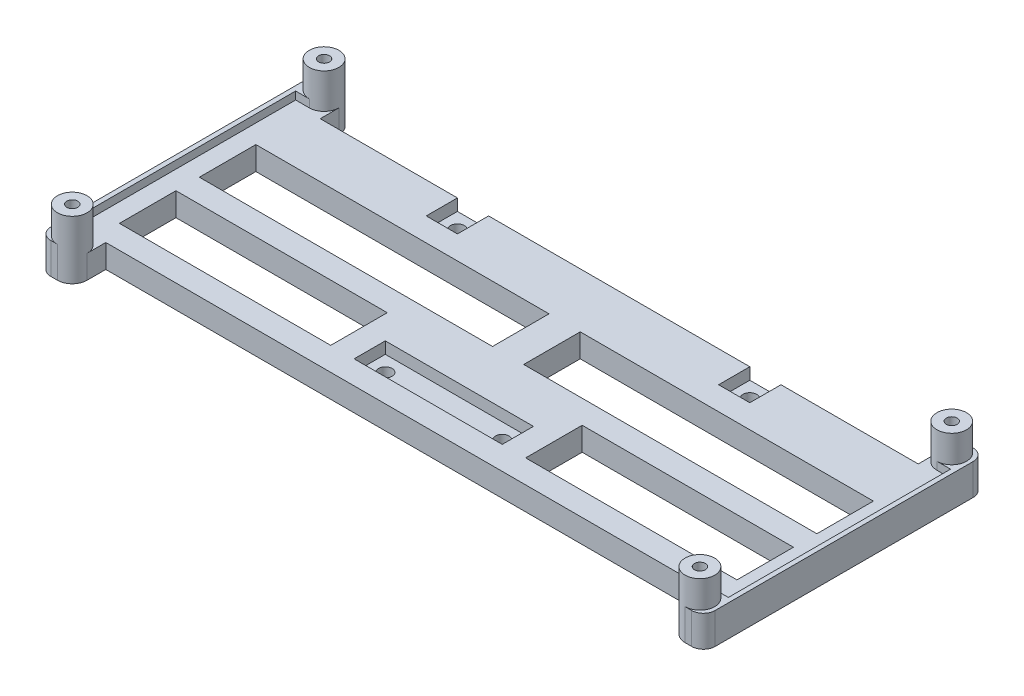
from build123d import *

# Parameters (mm, degrees)
SCHIZZO1_R                   = 1.4
ESTRUSIONE_ESTRUSIONE1_DEPTH = 6
SCHIZZO2_R                   = 3.8
SCHIZZO2_R_2                 = 1.4
ESTRUSIONE_ESTRUSIONE2_DEPTH = 9
SCHIZZO3_R                   = 1.75
TAGLIO_ESTRUSIONE1_DEPTH     = 93.969080882
SCHIZZO5_W                   = 8
SCHIZZO5_H                   = 8
SCHIZZO5_W_2                 = 38
TAGLIO_ESTRUSIONE2_DEPTH     = 3
SCHIZZO6_W                   = 75.2
SCHIZZO6_H                   = 14.5
SCHIZZO6_W_2                 = 54.2
TAGLIO_ESTRUSIONE3_DEPTH     = 93.969080882
ESTRUSIONE_ESTRUSIONE4_DEPTH = 2
RACCORDO1_R                  = 3


with BuildPart() as part:
    # Schizzo1 → Estrusione-Estrusione1 (new body)
    with BuildSketch(Plane(origin=(0, 0, 0), x_dir=(1, 0, 0), z_dir=(0, 1, 0))):
        with BuildLine():
            Line((-76.7, -27.5), (-76.7, -32.3))
            ThreePointArc((-76.7, -32.3), (-77.812994231, -34.987005769), (-80.5, -36.1))
            Line((-80.5, -36.1), (-85.2, -36.1))
            Line((-85.2, -36.1), (-85.2, 36.1))
            Line((-85.2, 36.1), (-80.5, 36.1))
            ThreePointArc((-80.5, 36.1), (-77.812994231, 34.987005769), (-76.7, 32.3))
            Line((-76.7, 32.3), (-76.7, 27.5))
            Line((-76.7, 27.5), (76.7, 27.5))
            Line((76.7, 27.5), (76.7, 32.3))
            ThreePointArc((76.7, 32.3), (77.812994231, 34.987005769), (80.5, 36.1))
            Line((80.5, 36.1), (85.2, 36.1))
            Line((85.2, 36.1), (85.2, -36.1))
            Line((85.2, -36.1), (80.5, -36.1))
            ThreePointArc((80.5, -36.1), (77.812994231, -34.987005769), (76.7, -32.3))
            Line((76.7, -32.3), (76.7, -27.5))
            Line((76.7, -27.5), (-76.7, -27.5))
        make_face()
        with Locations(Location((-80.5, 32.3, 0), (0, 0, 270))):
            Circle(SCHIZZO1_R, mode=Mode.SUBTRACT)
        with Locations(Location((-80.5, -32.3, 0), (0, 0, 270))):
            Circle(SCHIZZO1_R, mode=Mode.SUBTRACT)
        with Locations(Location((80.5, -32.3, 0), (0, 0, 270))):
            Circle(SCHIZZO1_R, mode=Mode.SUBTRACT)
        with Locations(Location((80.5, 32.3, 0), (0, 0, 270))):
            Circle(SCHIZZO1_R, mode=Mode.SUBTRACT)
    extrude(amount=ESTRUSIONE_ESTRUSIONE1_DEPTH)

    # Schizzo2 → Estrusione-Estrusione2 (add)
    # profile 1 of 4: a face of its own
    with BuildSketch(Plane(origin=(0, 6, 0), x_dir=(1, 0, 0), z_dir=(0, 1, 0))):
        with Locations(Location((-80.5, 32.3, 0), (0, 0, 90))):
            Circle(SCHIZZO2_R)
        with Locations(Location((-80.5, 32.3, 0), (0, 0, 270))):
            Circle(SCHIZZO2_R_2, mode=Mode.SUBTRACT)
    # profile 2 of 4: a face of its own
    with BuildSketch(Plane(origin=(0, 6, 0), x_dir=(1, 0, 0), z_dir=(0, 1, 0))):
        with Locations(Location((-80.5, -32.3, 0), (0, 0, 270))):
            Circle(SCHIZZO2_R)
        with Locations(Location((-80.5, -32.3, 0), (0, 0, 270))):
            Circle(SCHIZZO2_R_2, mode=Mode.SUBTRACT)
    # profile 3 of 4: a face of its own
    with BuildSketch(Plane(origin=(0, 6, 0), x_dir=(1, 0, 0), z_dir=(0, 1, 0))):
        with Locations(Location((80.5, -32.3, 0), (0, 0, 270))):
            Circle(SCHIZZO2_R)
        with Locations(Location((80.5, -32.3, 0), (0, 0, 270))):
            Circle(SCHIZZO2_R_2, mode=Mode.SUBTRACT)
    # profile 4 of 4: a face of its own
    with BuildSketch(Plane(origin=(0, 6, 0), x_dir=(1, 0, 0), z_dir=(0, 1, 0))):
        with Locations(Location((80.5, 32.3, 0), (0, 0, 90))):
            Circle(SCHIZZO2_R)
        with Locations(Location((80.5, 32.3, 0), (0, 0, 270))):
            Circle(SCHIZZO2_R_2, mode=Mode.SUBTRACT)
    extrude(amount=ESTRUSIONE_ESTRUSIONE2_DEPTH)

    # Schizzo3 → Taglio-Estrusione1 (cut, through all)
    with BuildSketch(Plane(origin=(0, 6, 0), x_dir=(1, 0, 0), z_dir=(0, 1, 0))):
        with Locations(Location((-37.5, 23.5, 0), (0, 0, 270))):
            Circle(SCHIZZO3_R)
        with Locations(Location((-15, -17.5, 0), (0, 0, 270))):
            Circle(SCHIZZO3_R)
        with Locations(Location((15, -17.5, 0), (0, 0, 270))):
            Circle(SCHIZZO3_R)
        with Locations(Location((37.5, 23.5, 0), (0, 0, 270))):
            Circle(SCHIZZO3_R)
    extrude(amount=-TAGLIO_ESTRUSIONE1_DEPTH, mode=Mode.SUBTRACT)

    # Schizzo5 → Taglio-Estrusione2 (cut)
    with BuildSketch(Plane(origin=(0, 6, 0), x_dir=(1, 0, 0), z_dir=(0, 1, 0))):
        with Locations((37.5, 23.5)):
            Rectangle(SCHIZZO5_W, SCHIZZO5_H)
        with Locations((-37.5, 23.5)):
            Rectangle(SCHIZZO5_W, SCHIZZO5_H)
        with Locations((0, -17.5)):
            Rectangle(SCHIZZO5_W_2, SCHIZZO5_H)
    extrude(amount=-TAGLIO_ESTRUSIONE2_DEPTH, mode=Mode.SUBTRACT)

    # Schizzo6 → Taglio-Estrusione3 (cut, through all)
    with BuildSketch(Plane(origin=(0, 6, 0), x_dir=(1, 0, 0), z_dir=(0, 1, 0))):
        with Locations((-41.6, 6.25)):
            Rectangle(SCHIZZO6_W, SCHIZZO6_H)
        with Locations((41.6, 6.25)):
            Rectangle(SCHIZZO6_W, SCHIZZO6_H)
        with Locations((-52.1, -14.25)):
            Rectangle(SCHIZZO6_W_2, SCHIZZO6_H)
        with Locations((52.1, -14.25)):
            Rectangle(SCHIZZO6_W_2, SCHIZZO6_H)
    extrude(amount=-TAGLIO_ESTRUSIONE3_DEPTH, mode=Mode.SUBTRACT)

    # Schizzo7 → Estrusione-Estrusione4 (add)
    with BuildSketch(Plane(origin=(0, 6, 0), x_dir=(1, 0, 0), z_dir=(0, 1, 0))):
        with BuildLine():
            Line((-80.5, 36.1), (-85.2, 36.1))
            Line((-85.2, 36.1), (-85.2, -36.1))
            Line((-85.2, -36.1), (-80.5, -36.1))
            ThreePointArc((-80.5, -36.1), (-84.3, -32.3), (-80.5, -28.5))
            Line((-80.5, -28.5), (-84, -28.5))
            Line((-84, -28.5), (-84, 28.5))
            Line((-84, 28.5), (-80.5, 28.5))
            ThreePointArc((-80.5, 28.5), (-84.3, 32.3), (-80.5, 36.1))
        make_face()
    estrusione_estrusione4 = extrude(amount=ESTRUSIONE_ESTRUSIONE4_DEPTH)

    # Specchia3: Estrusione-Estrusione4 across plane
    add(estrusione_estrusione4.mirror(Plane(origin=(0, 0, 0), x_dir=(0, 0, 1), z_dir=(1, 0, 0))))

    # Raccordo1
    raccordo1_edges = [part.edges().sort_by_distance(p)[0] for p in [
        (85.2, 4, -36.1),
        (85.2, 4, 36.1),
        (-85.2, 3, 36.1),
        (-85.2, 3, -36.1),
    ]]
    fillet(raccordo1_edges, radius=RACCORDO1_R)


solid = part.part
